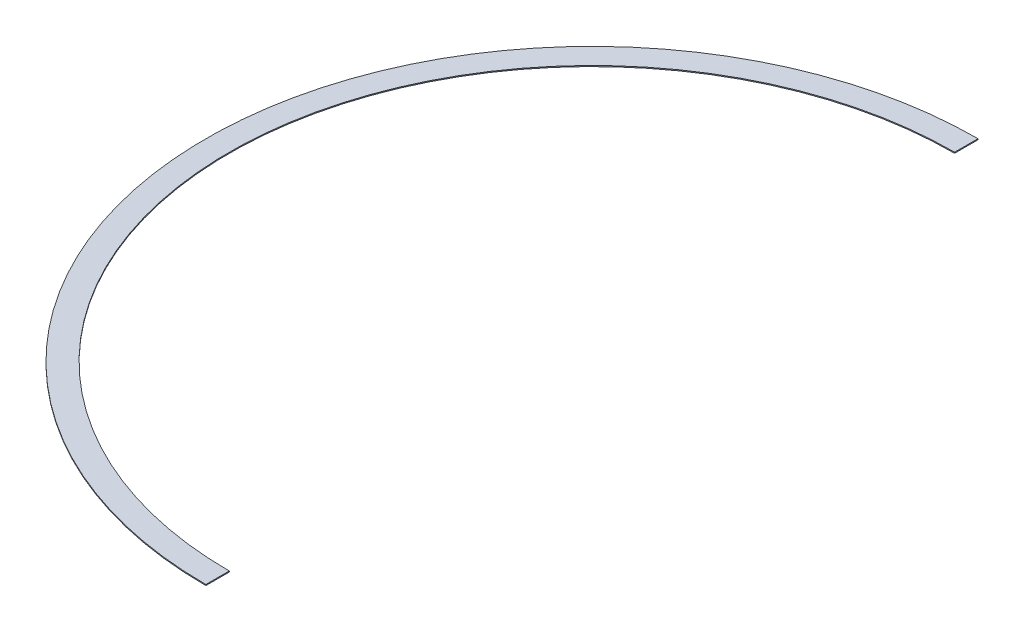
from build123d import *

# Parameters (mm, degrees)
EXTRUDE_THIN1_DEPTH = 0.79375


with BuildPart() as part:
    # Sketch1 → Extrude-Thin1 (new body)
    with BuildSketch(Plane(origin=(0, 0, 0), x_dir=(1, 0, 0), z_dir=(0, 1, 0))):
        with BuildLine():
            ThreePointArc((0, 314.325), (-314.325, 0), (0, -314.325))
            Line((0, -314.325), (0, -295.275))
            ThreePointArc((0, -295.275), (-295.275, 0), (0, 295.275))
            Line((0, 295.275), (0, 314.325))
        make_face()
    extrude(amount=EXTRUDE_THIN1_DEPTH)


solid = part.part
